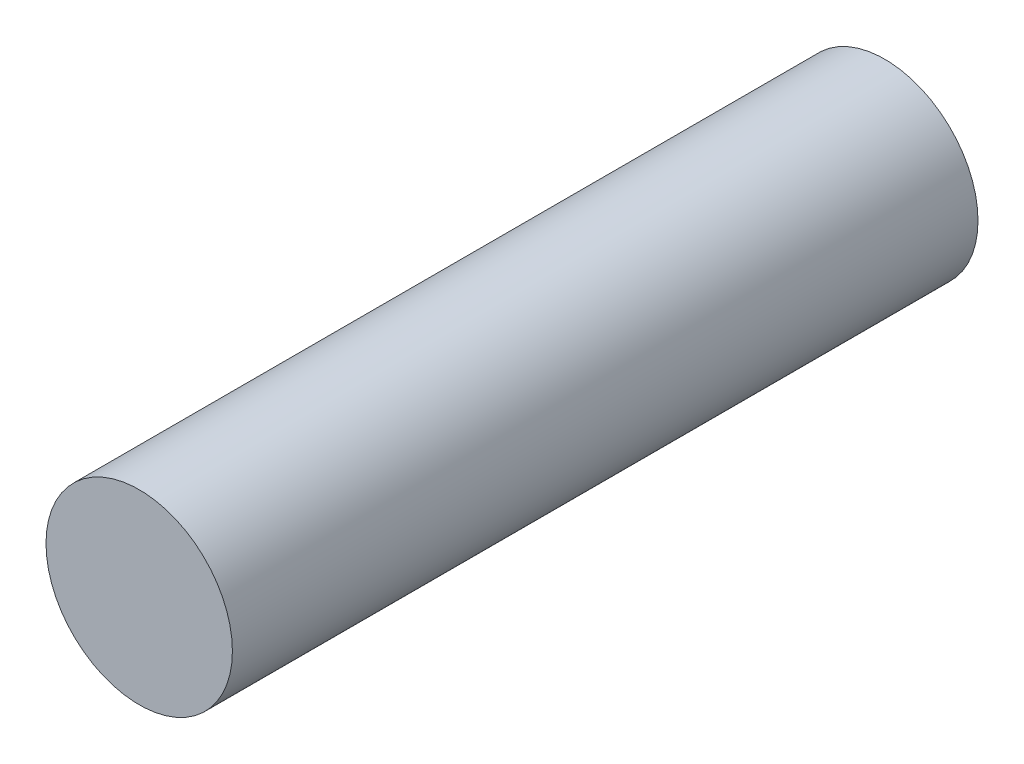
from build123d import *

# Parameters (mm, degrees)
BOSS_EXTRUDE1_START = -3.175
SKETCH3_R           = 0.79375
BOSS_EXTRUDE1_DEPTH = 6.35


with BuildPart() as part:
    # Sketch3 → Boss-Extrude1 (new body)
    with BuildSketch(Plane.XY.offset(BOSS_EXTRUDE1_START)):
        Circle(SKETCH3_R)
    extrude(amount=BOSS_EXTRUDE1_DEPTH)


solid = part.part
